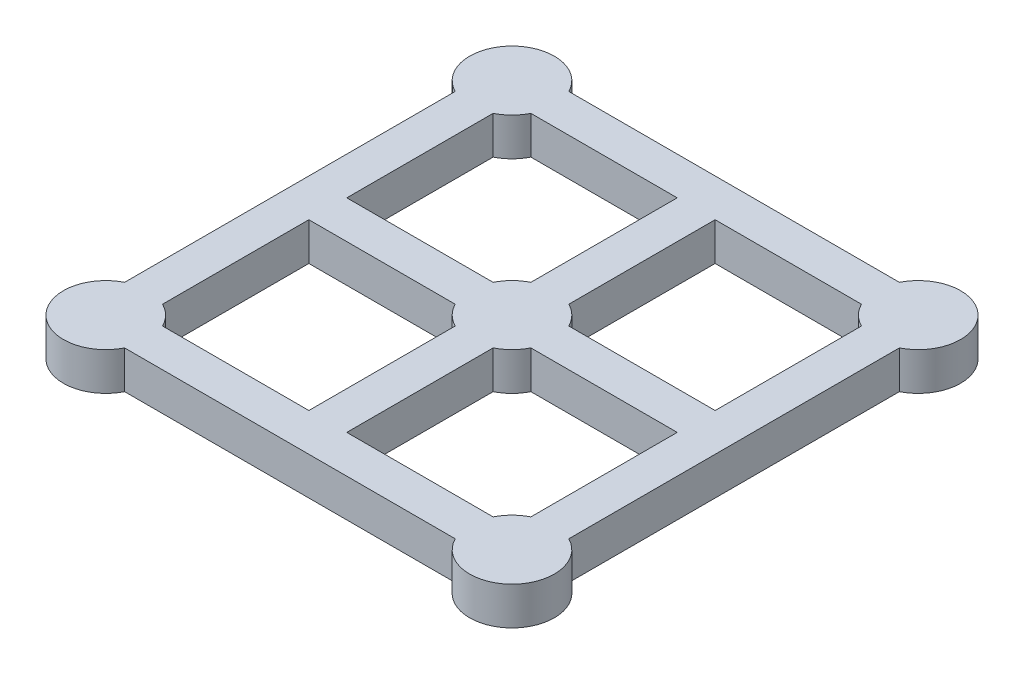
from build123d import *

# Parameters (mm, degrees)
BOSS_EXTRUDE1_DEPTH = 3.556


with BuildPart() as part:
    # Sketch2 → Boss-Extrude1 (new body)
    with BuildSketch(Plane(origin=(0, 0, 0), x_dir=(1, 0, 0), z_dir=(0, 1, 0))):
        with BuildLine():
            Line((15.501804323, -20.828), (-15.501804323, -20.828))
            ThreePointArc((-15.501804323, -20.828), (-21.856330038, -21.856330038), (-20.828, -15.501804323))
            Line((-20.828, -15.501804323), (-20.828, 15.501804323))
            ThreePointArc((-20.828, 15.501804323), (-21.856330038, 21.856330038), (-15.501804323, 20.828))
            Line((-15.501804323, 20.828), (15.501804323, 20.828))
            ThreePointArc((15.501804323, 20.828), (21.856330038, 21.856330038), (20.828, 15.501804323))
            Line((20.828, 15.501804323), (20.828, -15.501804323))
            ThreePointArc((20.828, -15.501804323), (21.856330038, -21.856330038), (15.501804323, -20.828))
        make_face()
        with BuildLine():
            Line((-15.501804323, -17.272), (-1.778, -17.272))
            Line((-1.778, -17.272), (-1.778, -3.548195677))
            ThreePointArc((-1.778, -3.548195677), (-2.806330038, -2.806330038), (-3.548195677, -1.778))
            Line((-3.548195677, -1.778), (-17.272, -1.778))
            Line((-17.272, -1.778), (-17.272, -15.501804323))
            ThreePointArc((-17.272, -15.501804323), (-16.243669962, -16.243669962), (-15.501804323, -17.272))
        make_face(mode=Mode.SUBTRACT)
        with BuildLine():
            Line((-15.501804323, 17.272), (-1.778, 17.272))
            Line((-1.778, 17.272), (-1.778, 3.548195677))
            ThreePointArc((-1.778, 3.548195677), (-2.806330038, 2.806330038), (-3.548195677, 1.778))
            Line((-3.548195677, 1.778), (-17.272, 1.778))
            Line((-17.272, 1.778), (-17.272, 15.501804323))
            ThreePointArc((-17.272, 15.501804323), (-16.243669962, 16.243669962), (-15.501804323, 17.272))
        make_face(mode=Mode.SUBTRACT)
        with BuildLine():
            Line((17.272, -15.501804323), (17.272, -1.778))
            Line((17.272, -1.778), (3.548195677, -1.778))
            ThreePointArc((3.548195677, -1.778), (2.806330038, -2.806330038), (1.778, -3.548195677))
            Line((1.778, -3.548195677), (1.778, -17.272))
            Line((1.778, -17.272), (15.501804323, -17.272))
            ThreePointArc((15.501804323, -17.272), (16.243669962, -16.243669962), (17.272, -15.501804323))
        make_face(mode=Mode.SUBTRACT)
        with BuildLine():
            Line((1.778, 17.272), (1.778, 3.548195677))
            ThreePointArc((1.778, 3.548195677), (2.806330038, 2.806330038), (3.548195677, 1.778))
            Line((3.548195677, 1.778), (17.272, 1.778))
            Line((17.272, 1.778), (17.272, 15.501804323))
            ThreePointArc((17.272, 15.501804323), (16.243669962, 16.243669962), (15.501804323, 17.272))
            Line((15.501804323, 17.272), (1.778, 17.272))
        make_face(mode=Mode.SUBTRACT)
    extrude(amount=BOSS_EXTRUDE1_DEPTH)


solid = part.part
